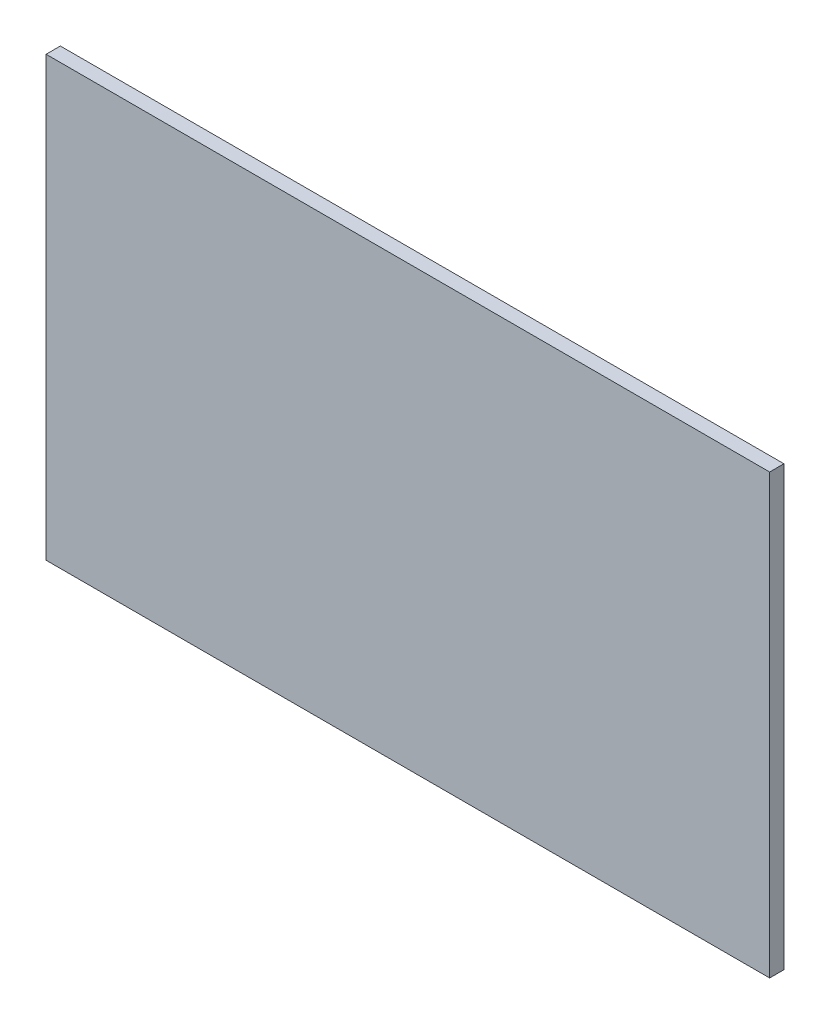
from build123d import *

# Parameters (mm, degrees)
SKETCH_1_W      = 355
SKETCH_1_H      = 215
EXTRUDE_1_DEPTH = 7
SKETCH_2_R      = 3
SKETCH_2_R_2    = 0.5
EXTRUDE_2_DEPTH = 7


with BuildPart() as part:
    # 草图1 → 凸台-拉伸1 (new body)
    with BuildSketch(Plane.XY):
        with Locations((177.5, -107.5)):
            Rectangle(SKETCH_1_W, SKETCH_1_H)
    extrude(amount=EXTRUDE_1_DEPTH)

    # 草图2 → 凸台-拉伸2 (add)
    with BuildSketch(Plane(origin=(0, 0, 0), x_dir=(-1, 0, 0), z_dir=(0, 0, -1))):
        Polygon((-177.5, -175), (-107.5, -175), (-107.5, -125), (-107.5, -105), (-247.5, -105), (-247.5, -175), align=None)
        with Locations((-177.5, -135)):
            Circle(SKETCH_2_R, mode=Mode.SUBTRACT)
        with Locations((-192.5, -135)):
            Circle(SKETCH_2_R_2, mode=Mode.SUBTRACT)
    extrude(amount=EXTRUDE_2_DEPTH)


solid = part.part
